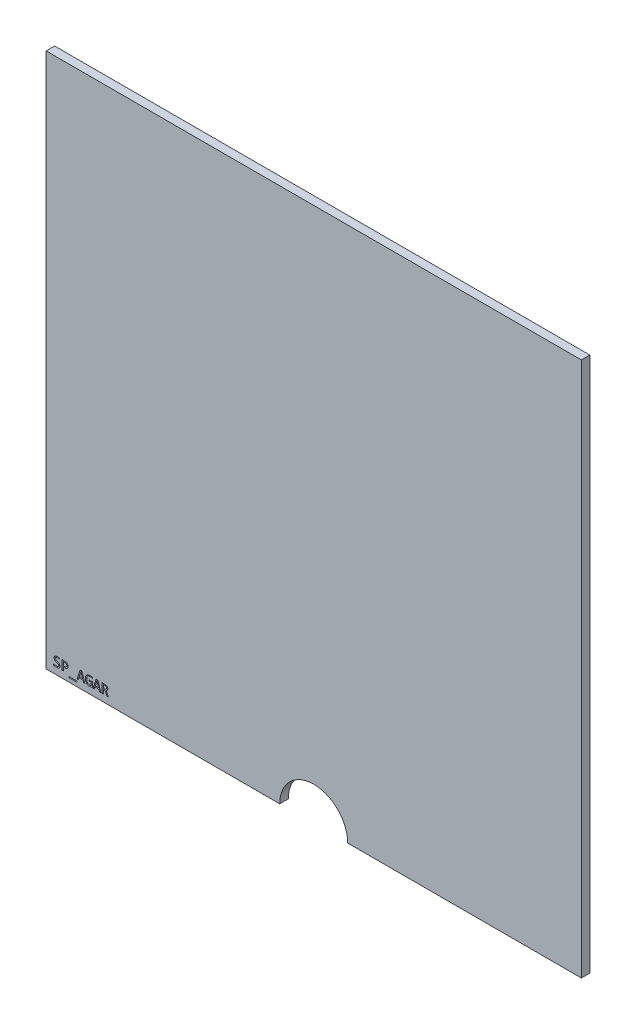
from build123d import *

# Parameters (mm, degrees)
SKETCH1_W           = 199.873
SKETCH1_H           = 199.873
BOSS_EXTRUDE1_DEPTH = 3.175
CUT_EXTRUDE3_DEPTH  = 3.175
SKETCH4_W           = 2.992753624
SKETCH4_H           = 0.405797101
CUT_EXTRUDE4_DEPTH  = 1.5875


with BuildPart() as part:
    # Sketch1 → Boss-Extrude1 (new body)
    with BuildSketch(Plane.XY):
        with Locations((99.9365, 99.9365)):
            Rectangle(SKETCH1_W, SKETCH1_H)
    extrude(amount=BOSS_EXTRUDE1_DEPTH)

    # Sketch3 → Cut-Extrude3 (cut)
    with BuildSketch(Plane.XY.offset(3.175)):
        with BuildLine():
            Line((87.2365, 0), (112.6365, 0))
            ThreePointArc((112.6365, 0), (99.9365, 12.7), (87.2365, 0))
        make_face()
    extrude(amount=-CUT_EXTRUDE3_DEPTH, mode=Mode.SUBTRACT)

    # Sketch4 → Cut-Extrude4 (cut)
    # profile 1 of 7: a face of its own
    with BuildSketch(Plane.XY.offset(3.175)):
        with BuildLine():
            add(Edge.make_bspline(
                [(5.228405797, 3.487124094), (5.227266764, 3.446625552), (5.22505706, 3.368059062), (5.205615497, 3.25373574), (5.173193105, 3.147546701), (5.128639573, 3.048765061), (5.071324609, 2.959184846), (5.005857949, 2.875573602), (4.927685272, 2.802028794), (4.841083014, 2.73506281), (4.744698491, 2.6761281), (4.638285069, 2.626529155), (4.523301542, 2.583680145), (4.399428448, 2.549130879), (4.267773395, 2.522273494), (4.128986235, 2.503823356), (3.983764262, 2.491370796), (3.884758327, 2.48998304), (3.834270833, 2.489275362)],
                knots=[0, 0, 0, 0, 1.005643061, 1.95093061, 2.870738502, 3.757832008, 4.633806625, 5.507195241, 6.389247641, 7.292512577, 8.223494331, 9.189475669, 10.205094408, 11.269007441, 12.381228937, 13.540657028, 14.745872513, 16, 16, 16, 16], degree=3))
            add(Edge.make_bspline(
                [(3.834270833, 2.489275362), (3.787766914, 2.489796415), (3.694981735, 2.490836027), (3.557002566, 2.497209299), (3.422014443, 2.507737719), (3.292034494, 2.520398072), (3.168047801, 2.534471705), (3.05169692, 2.550748169), (2.944449477, 2.569673872), (2.876545875, 2.583953585), (2.844347826, 2.590724638)],
                knots=[0, 0, 0, 0, 1.119729043, 2.234096861, 3.324996266, 4.379512959, 5.378439906, 6.329323539, 7.207810484, 8, 8, 8, 8], degree=3))
            Line((2.844347826, 2.590724638), (2.844347826, 3.047246377))
            add(Edge.make_bspline(
                [(2.844347826, 3.047246377), (2.878819954, 3.035435179), (2.949255196, 3.011301925), (3.059739435, 2.98299581), (3.175633781, 2.956411992), (3.298039502, 2.934202867), (3.428149129, 2.916723199), (3.56645907, 2.90442996), (3.713433951, 2.896105078), (3.814180087, 2.89542308), (3.865973732, 2.895072464)],
                knots=[0, 0, 0, 0, 0.842364813, 1.72116351, 2.635659137, 3.591954833, 4.596841017, 5.670471508, 6.802388115, 8, 8, 8, 8], degree=3))
            add(Edge.make_bspline(
                [(3.865973732, 2.895072464), (3.902977798, 2.895453386), (3.974153504, 2.896186074), (4.076714073, 2.903846153), (4.170893397, 2.913832958), (4.256488592, 2.931179209), (4.334358709, 2.951144887), (4.404743483, 2.976551906), (4.467531865, 3.006787736), (4.523819188, 3.040683462), (4.572058653, 3.079846937), (4.614351908, 3.122053382), (4.648292378, 3.169136711), (4.675862477, 3.219979551), (4.696243596, 3.274753843), (4.710397006, 3.333314957), (4.719300388, 3.395443244), (4.720528803, 3.438217909), (4.72115942, 3.46017663)],
                knots=[0, 0, 0, 0, 1.523194236, 2.929797672, 4.233142745, 5.41923506, 6.522104548, 7.540643951, 8.494207191, 9.387815665, 10.238903194, 11.04655015, 11.840679357, 12.619387111, 13.4214478, 14.239285369, 15.096122854, 16, 16, 16, 16], degree=3))
            add(Edge.make_bspline(
                [(4.72115942, 3.46017663), (4.720372425, 3.48299288), (4.7188348, 3.527571032), (4.70312902, 3.591525071), (4.678573143, 3.650832352), (4.64257298, 3.703725584), (4.600266558, 3.753423272), (4.550566152, 3.798962158), (4.495703863, 3.842997309), (4.412458886, 3.898373471), (4.295976068, 3.963442677), (4.140807768, 4.028512906), (3.976261288, 4.093847352), (3.807392378, 4.161991506), (3.638566522, 4.234326796), (3.472941708, 4.310958307), (3.31760458, 4.39887056), (3.200632959, 4.486103075), (3.118908143, 4.564653124), (3.063309585, 4.627547471), (3.015603636, 4.696227572), (2.971534045, 4.768264424), (2.937055755, 4.847872951), (2.913134645, 4.93430508), (2.897259757, 5.027571644), (2.89581851, 5.092013653), (2.895072464, 5.125371377)],
                knots=[0, 0, 0, 0, 0.619815692, 1.2109895, 1.781199776, 2.357496674, 2.943929778, 3.554333405, 4.188738872, 4.856760597, 6.272963823, 7.811824644, 9.431291666, 11.092170587, 12.76691914, 14.429617761, 16.056218893, 17.616396577, 18.384212937, 19.138341755, 19.896401647, 20.65718422, 21.4332038, 22.247956952, 23.09307348, 24, 24, 24, 24], degree=3))
            add(Edge.make_bspline(
                [(2.895072464, 5.125371377), (2.895981812, 5.155282444), (2.897802742, 5.215178069), (2.912844759, 5.304676278), (2.936502024, 5.393392489), (2.969807578, 5.481004027), (3.013433636, 5.565483216), (3.066527686, 5.646472931), (3.131743266, 5.721041003), (3.206524054, 5.791352689), (3.293039001, 5.855683015), (3.390206809, 5.914366786), (3.499608282, 5.964728655), (3.619149197, 6.010430745), (3.751239492, 6.046708687), (3.895224255, 6.072699081), (4.051131666, 6.08736788), (4.158930699, 6.089580061), (4.214705616, 6.090724638)],
                knots=[0, 0, 0, 0, 0.784067079, 1.570060577, 2.373452904, 3.189297991, 4.022898002, 4.862695015, 5.722463422, 6.614650011, 7.550049647, 8.544652583, 9.586108202, 10.704431291, 11.897970904, 13.172772987, 14.537200697, 16, 16, 16, 16], degree=3))
            add(Edge.make_bspline(
                [(4.214705616, 6.090724638), (4.245891922, 6.090522584), (4.310704848, 6.090102665), (4.410570232, 6.08292358), (4.514731163, 6.073869386), (4.620646371, 6.060899173), (4.726384643, 6.046092082), (4.830192456, 6.028634687), (4.929843484, 6.010002367), (4.994361992, 5.996023454), (5.025507246, 5.989275362)],
                knots=[0, 0, 0, 0, 0.91416123, 1.89985515, 2.934260182, 3.979599391, 5.027947684, 6.064525625, 7.065681407, 8, 8, 8, 8], degree=3))
            Line((5.025507246, 5.989275362), (5.025507246, 5.583478261))
            add(Edge.make_bspline(
                [(5.025507246, 5.583478261), (4.956183349, 5.598853842), (4.818223137, 5.629452503), (4.610592859, 5.659976163), (4.406687986, 5.681352467), (4.272087657, 5.683750095), (4.205987319, 5.684927536)],
                knots=[0, 0, 0, 0, 1.029411825, 2.048613503, 3.041701399, 4, 4, 4, 4], degree=3))
            add(Edge.make_bspline(
                [(4.205987319, 5.684927536), (4.172690979, 5.684418592), (4.108149628, 5.683432059), (4.014711488, 5.677366544), (3.928194847, 5.666259452), (3.848511804, 5.65123715), (3.775442151, 5.632646828), (3.709210768, 5.609028635), (3.650182539, 5.580199516), (3.597364292, 5.547808177), (3.5515315, 5.511139497), (3.51124071, 5.472210953), (3.477602281, 5.4298804), (3.450448934, 5.384155385), (3.429199273, 5.335643847), (3.412696302, 5.284548642), (3.404320417, 5.230002438), (3.402996136, 5.192763781), (3.402318841, 5.173718297)],
                knots=[0, 0, 0, 0, 1.491437277, 2.890989782, 4.191431573, 5.395946596, 6.521058188, 7.565423013, 8.539223212, 9.458660202, 10.334655275, 11.163081303, 11.963306063, 12.748694206, 13.538083787, 14.331542868, 15.146677777, 16, 16, 16, 16], degree=3))
            add(Edge.make_bspline(
                [(3.402318841, 5.173718297), (3.403104951, 5.150904278), (3.404640847, 5.106330482), (3.420417447, 5.04210732), (3.445104611, 4.982633271), (3.479620604, 4.928089093), (3.523588994, 4.879476368), (3.571982195, 4.832189166), (3.627038764, 4.78782674), (3.710120581, 4.731025805), (3.827631124, 4.666295603), (3.982038875, 4.598381625), (4.147497871, 4.534908954), (4.315968102, 4.466096529), (4.48540011, 4.394513757), (4.623487314, 4.327921333), (4.730656938, 4.270757171), (4.805760309, 4.222836293), (4.8770712, 4.172295367), (4.94264164, 4.116458564), (5.004175029, 4.057402372), (5.059180937, 3.992488782), (5.108248335, 3.923131391), (5.150556911, 3.848632473), (5.186744812, 3.768840648), (5.210343139, 3.681054616), (5.226224779, 3.586508637), (5.227662114, 3.521012218), (5.228405797, 3.487124094)],
                knots=[0, 0, 0, 0, 0.667485538, 1.304126353, 1.925325377, 2.548259058, 3.18485279, 3.841928735, 4.529978862, 5.253739616, 6.789399884, 8.452896455, 10.194043647, 11.982660287, 13.786213269, 15.583473082, 16.473910229, 17.343881083, 18.192645259, 19.033319022, 19.865571682, 20.689426309, 21.522902605, 22.351690537, 23.197589349, 24.082454772, 25.007853999, 26, 26, 26, 26], degree=3))
        make_face()
    # profile 2 of 7: a face of its own
    with BuildSketch(Plane.XY.offset(3.175)):
        with BuildLine():
            add(Edge.make_bspline(
                [(8.22115942, 4.974782609), (8.220302894, 4.939326782), (8.218582139, 4.868096333), (8.202696182, 4.761757409), (8.178096863, 4.655988321), (8.144304843, 4.551484574), (8.099987867, 4.44979002), (8.044608656, 4.352717353), (7.976911398, 4.2620901), (7.900331233, 4.175978832), (7.811787003, 4.097275926), (7.711702304, 4.026363923), (7.60036061, 3.963232209), (7.478096, 3.907053241), (7.34330574, 3.862967387), (7.196363773, 3.83025246), (7.036747941, 3.811546406), (6.926144982, 3.809284148), (6.869030797, 3.808115942)],
                knots=[0, 0, 0, 0, 0.84837333, 1.704374698, 2.568122001, 3.446177459, 4.329841521, 5.219461111, 6.115085959, 7.03322926, 7.973947317, 8.94447037, 9.964314875, 11.034235969, 12.160282575, 13.352588404, 14.632904974, 16, 16, 16, 16], degree=3))
            Line((6.869030797, 3.808115942), (6.445797101, 3.808115942))
            Line((6.445797101, 3.808115942), (6.445797101, 2.54))
            Line((6.445797101, 2.54), (5.938550725, 2.54))
            Line((5.938550725, 2.54), (5.938550725, 6.04))
            Line((5.938550725, 6.04), (6.917377717, 6.04))
            add(Edge.make_bspline(
                [(6.917377717, 6.04), (6.959941394, 6.039549216), (7.044426355, 6.038654453), (7.169516284, 6.026676321), (7.292187032, 6.009802458), (7.411439952, 5.984576676), (7.52594833, 5.951481773), (7.634735935, 5.911085502), (7.734797955, 5.858396307), (7.82875908, 5.799354905), (7.915294548, 5.731198941), (7.991423015, 5.652104844), (8.05856476, 5.563992966), (8.11671534, 5.467070451), (8.164593236, 5.359695254), (8.196770828, 5.240725181), (8.218372446, 5.111360667), (8.220208647, 5.021376049), (8.22115942, 4.974782609)],
                knots=[0, 0, 0, 0, 1.071095419, 2.126025337, 3.160633674, 4.187194637, 5.191188192, 6.159546808, 7.102471747, 8.032359578, 8.950543616, 9.867691343, 10.788184798, 11.733733012, 12.707489344, 13.737062018, 14.82826569, 16, 16, 16, 16], degree=3))
        make_face()
        with BuildLine():
            add(Edge.make_bspline(
                [(7.713913043, 4.947835145), (7.713407051, 4.974818736), (7.712420853, 5.027410763), (7.701819742, 5.1035743), (7.685125987, 5.174967865), (7.66238668, 5.241529586), (7.632908306, 5.303457597), (7.596049145, 5.359904763), (7.552976997, 5.412049222), (7.502962119, 5.45866116), (7.44698721, 5.499691387), (7.386732484, 5.536780189), (7.320255297, 5.566751134), (7.24847029, 5.591047145), (7.171773898, 5.611244221), (7.089422495, 5.623954604), (7.002401702, 5.633391921), (6.942504142, 5.633928241), (6.91182971, 5.634202899)],
                knots=[0, 0, 0, 0, 1.07893025, 2.102875295, 3.069403633, 4.00867391, 4.911619206, 5.805799344, 6.69897942, 7.61127936, 8.532960211, 9.47193309, 10.436783978, 11.442898866, 12.50165651, 13.605056338, 14.773513735, 16, 16, 16, 16], degree=3))
            Line((6.91182971, 5.634202899), (6.445797101, 5.634202899))
            Line((6.445797101, 5.634202899), (6.445797101, 4.213913043))
            Line((6.445797101, 4.213913043), (6.871408514, 4.213913043))
            add(Edge.make_bspline(
                [(6.871408514, 4.213913043), (6.904182755, 4.214623908), (6.967714485, 4.216001896), (7.060450992, 4.223725056), (7.147483266, 4.237616516), (7.228416757, 4.258512851), (7.303599878, 4.283741726), (7.37316686, 4.314559597), (7.436759035, 4.352093161), (7.494875668, 4.394874743), (7.547116002, 4.443314655), (7.591486254, 4.498715821), (7.629884201, 4.559147433), (7.661095556, 4.62570411), (7.684456906, 4.69826228), (7.701993074, 4.776208811), (7.712420235, 4.860104967), (7.713404544, 4.917951365), (7.713913043, 4.947835145)],
                knots=[0, 0, 0, 0, 1.232805628, 2.389751021, 3.4973379, 4.54330244, 5.530003372, 6.477393866, 7.399377973, 8.301660217, 9.187431021, 10.070466494, 10.963674817, 11.874940633, 12.827061481, 13.825105319, 14.876436953, 16, 16, 16, 16], degree=3))
        make_face(mode=Mode.SUBTRACT)
    # profile 3 of 7: a face of its own
    with BuildSketch(Plane.XY.offset(3.175)):
        with Locations((10.021884058, 1.626956522)):
            Rectangle(SKETCH4_W, SKETCH4_H)
    # profile 4 of 7: a face of its own
    with BuildSketch(Plane.XY.offset(3.175)):
        Polygon((14.485652174, 2.54), (13.96651721, 2.54), (13.731915761, 3.300869565), (12.278337862, 3.300869565), (12.038188406, 2.54), (11.543623188, 2.54), (12.707119565, 6.04), (13.359406703, 6.04), align=None)
        Polygon((13.607481884, 3.706666667), (13.014637681, 5.631825181), (12.406734601, 3.706666667), align=None, mode=Mode.SUBTRACT)
    # profile 5 of 7: a face of its own
    with BuildSketch(Plane.XY.offset(3.175)):
        with BuildLine():
            add(Edge.make_bspline(
                [(17.250144928, 5.482028986), (17.182806781, 5.511978827), (17.048533315, 5.571699345), (16.87208751, 5.625300698), (16.726893041, 5.65625715), (16.613045117, 5.672665486), (16.494501456, 5.68338069), (16.413740738, 5.684406896), (16.37276721, 5.684927536)],
                knots=[0, 0, 0, 0, 1.45945927, 2.910187841, 3.643322816, 4.400006487, 5.188251666, 6, 6, 6, 6], degree=3))
            add(Edge.make_bspline(
                [(16.37276721, 5.684927536), (16.326193959, 5.683803129), (16.235282716, 5.681608279), (16.103133424, 5.661793954), (15.978363469, 5.631676224), (15.862471477, 5.586724129), (15.754877064, 5.531098619), (15.655595804, 5.464764861), (15.565203172, 5.387851723), (15.483977739, 5.300617041), (15.411042876, 5.204303764), (15.349121726, 5.097187075), (15.293677294, 4.982025168), (15.249188548, 4.857287873), (15.212959692, 4.724928879), (15.189666574, 4.584920992), (15.172467647, 4.438635229), (15.171121905, 4.338665689), (15.170434783, 4.287622283)],
                knots=[0, 0, 0, 0, 1.073569988, 2.0956145, 3.075462191, 4.028316933, 4.954955511, 5.864200373, 6.776299374, 7.685952519, 8.608514939, 9.556388192, 10.53488969, 11.552674678, 12.606592505, 13.695564134, 14.823379042, 16, 16, 16, 16], degree=3))
            add(Edge.make_bspline(
                [(15.170434783, 4.287622283), (15.171169335, 4.234499795), (15.172596544, 4.131284738), (15.184421139, 3.980352608), (15.205208807, 3.838326192), (15.232153115, 3.704202904), (15.2693269, 3.579794763), (15.315364993, 3.464836244), (15.37011566, 3.359383365), (15.434164881, 3.263691992), (15.508666807, 3.178903883), (15.592511867, 3.104558254), (15.686090395, 3.040918287), (15.78897782, 2.987080335), (15.902709061, 2.946294944), (16.02612282, 2.915917399), (16.160412006, 2.898834156), (16.253305723, 2.896356292), (16.301435688, 2.895072464)],
                knots=[0, 0, 0, 0, 1.243148344, 2.415391902, 3.539864978, 4.600895424, 5.61417527, 6.574020235, 7.494941044, 8.390096718, 9.261974012, 10.129213218, 11.00555139, 11.904308457, 12.839297802, 13.826028221, 14.87362472, 16, 16, 16, 16], degree=3))
            add(Edge.make_bspline(
                [(16.301435688, 2.895072464), (16.319143016, 2.895452788), (16.35591645, 2.896242621), (16.412484563, 2.900414017), (16.470951659, 2.90643611), (16.529801397, 2.915563979), (16.587833677, 2.925350484), (16.643701854, 2.937869364), (16.695257652, 2.952611824), (16.727626383, 2.964136649), (16.742898551, 2.969574275)],
                knots=[0, 0, 0, 0, 0.945101657, 1.962726016, 3.026203458, 4.081046807, 5.14040368, 6.166587829, 7.134962126, 8, 8, 8, 8], degree=3))
            Line((16.742898551, 2.969574275), (16.742898551, 4.112463768))
            Line((16.742898551, 4.112463768), (16.039094203, 4.112463768))
            Line((16.039094203, 4.112463768), (16.039094203, 4.51826087))
            Line((16.039094203, 4.51826087), (17.250144928, 4.51826087))
            Line((17.250144928, 4.51826087), (17.250144928, 2.7040625))
            add(Edge.make_bspline(
                [(17.250144928, 2.7040625), (17.212030466, 2.687209541), (17.134620574, 2.652981437), (17.013509459, 2.609920196), (16.888006837, 2.572995057), (16.759782049, 2.541941469), (16.630357029, 2.518286463), (16.501732082, 2.502094738), (16.375867827, 2.490982207), (16.293004167, 2.489837645), (16.252296196, 2.489275362)],
                knots=[0, 0, 0, 0, 0.972427008, 1.974984516, 2.997371287, 4.024859125, 5.052920405, 6.066341974, 7.050062525, 8, 8, 8, 8], degree=3))
            add(Edge.make_bspline(
                [(16.252296196, 2.489275362), (16.192516881, 2.490549453), (16.075728807, 2.493038584), (15.905256974, 2.515274874), (15.743727748, 2.549480568), (15.591461347, 2.598767242), (15.449568762, 2.662014428), (15.317869162, 2.738920694), (15.197107688, 2.829274622), (15.087712854, 2.933851987), (14.990702252, 3.052357507), (14.904212218, 3.183681128), (14.832166482, 3.329870624), (14.769457878, 3.488255203), (14.721570471, 3.660689086), (14.688096188, 3.846156273), (14.667109295, 4.0443509), (14.664521751, 4.180834715), (14.663188406, 4.251163949)],
                knots=[0, 0, 0, 0, 1.063600106, 2.077906186, 3.054673402, 3.998980003, 4.920963561, 5.814580945, 6.708049843, 7.599412522, 8.501355178, 9.428695674, 10.391875437, 11.396983258, 12.456970005, 13.571147305, 14.748427771, 16, 16, 16, 16], degree=3))
            add(Edge.make_bspline(
                [(14.663188406, 4.251163949), (14.66473007, 4.321234262), (14.667746396, 4.458329538), (14.690669068, 4.658107727), (14.729684379, 4.84663748), (14.783231229, 5.023466999), (14.85144206, 5.188384709), (14.933425414, 5.339812268), (15.026352309, 5.479490294), (15.133091482, 5.60489742), (15.251454232, 5.717268475), (15.3817524, 5.815145369), (15.522452685, 5.899863312), (15.67485881, 5.968617982), (15.836566965, 6.023121167), (16.007093479, 6.063142199), (16.185885016, 6.086052266), (16.30771206, 6.089150711), (16.36959692, 6.090724638)],
                knots=[0, 0, 0, 0, 1.187604435, 2.323594002, 3.403022287, 4.447090083, 5.450927467, 6.422737292, 7.361747858, 8.289531684, 9.208213513, 10.122694231, 11.046633145, 11.986550994, 12.950975564, 13.935151001, 14.951112262, 16, 16, 16, 16], degree=3))
            add(Edge.make_bspline(
                [(16.36959692, 6.090724638), (16.4484184, 6.089304178), (16.602612794, 6.086525405), (16.792348147, 6.061949095), (16.938516804, 6.034804237), (17.044841143, 6.008450996), (17.148962635, 5.977063325), (17.216468098, 5.951368998), (17.250144928, 5.938550725)],
                knots=[0, 0, 0, 0, 1.577605647, 3.086188538, 3.823906723, 4.553997738, 5.27862473, 6, 6, 6, 6], degree=3))
            Line((17.250144928, 5.938550725), (17.250144928, 5.482028986))
        make_face()
    # profile 6 of 7: a face of its own
    with BuildSketch(Plane.XY.offset(3.175)):
        Polygon((20.47115942, 2.54), (19.952024457, 2.54), (19.717423007, 3.300869565), (18.263845109, 3.300869565), (18.023695652, 2.54), (17.529130435, 2.54), (18.692626812, 6.04), (19.344913949, 6.04), align=None)
        Polygon((19.59298913, 3.706666667), (19.000144928, 5.631825181), (18.392241848, 3.706666667), align=None, mode=Mode.SUBTRACT)
    # profile 7 of 7: a face of its own
    with BuildSketch(Plane.XY.offset(3.175)):
        with BuildLine():
            Line((23.286376812, 2.54), (22.749012681, 2.54))
            Line((22.749012681, 2.54), (22.245729167, 3.632957428))
            add(Edge.make_bspline(
                [(22.245729167, 3.632957428), (22.22754342, 3.671706773), (22.193806601, 3.743591622), (22.134405718, 3.837982497), (22.072882901, 3.914032892), (22.006239721, 3.972499767), (21.933534151, 4.015154031), (21.854305587, 4.042750588), (21.767404678, 4.058792395), (21.706853095, 4.060724962), (21.675076993, 4.06173913)],
                knots=[0, 0, 0, 0, 1.339134837, 2.484261414, 3.482991323, 4.391871607, 5.244507385, 6.105289549, 7.005698766, 8, 8, 8, 8], degree=3))
            Line((21.675076993, 4.06173913), (21.460289855, 4.06173913))
            Line((21.460289855, 4.06173913), (21.460289855, 2.54))
            Line((21.460289855, 2.54), (20.953043478, 2.54))
            Line((20.953043478, 2.54), (20.953043478, 6.04))
            Line((20.953043478, 6.04), (21.883523551, 6.04))
            add(Edge.make_bspline(
                [(21.883523551, 6.04), (21.9324299, 6.039366361), (22.026722454, 6.038144689), (22.162871919, 6.025266173), (22.288375069, 6.004490516), (22.403038407, 5.974095291), (22.507638981, 5.936954567), (22.602535254, 5.892570659), (22.687740175, 5.841200811), (22.762928229, 5.78258738), (22.829396971, 5.71862251), (22.88517697, 5.646973978), (22.932477508, 5.569801302), (22.969599187, 5.485927791), (22.997746031, 5.397009504), (23.01875607, 5.303467957), (23.030485816, 5.205195092), (23.031989414, 5.138082264), (23.032753623, 5.10397192)],
                knots=[0, 0, 0, 0, 1.390037284, 2.680023546, 3.883960013, 5.002565466, 6.047913656, 7.03574216, 7.976084698, 8.870016629, 9.741095147, 10.591561451, 11.444313202, 12.308368875, 13.191986167, 14.092206828, 15.030357037, 16, 16, 16, 16], degree=3))
            add(Edge.make_bspline(
                [(23.032753623, 5.10397192), (23.03212023, 5.076470167), (23.030874584, 5.022384571), (23.021718934, 4.942416754), (23.007855725, 4.864646937), (22.987083404, 4.78943529), (22.960888528, 4.717074993), (22.929252746, 4.647623321), (22.89086214, 4.581847098), (22.847405833, 4.519061153), (22.797960232, 4.460279445), (22.743352113, 4.405303891), (22.682275584, 4.355425286), (22.617089624, 4.308559939), (22.5460113, 4.267093549), (22.469758896, 4.231662975), (22.388720441, 4.201184091), (22.332263604, 4.185973394), (22.303586957, 4.178247283)],
                knots=[0, 0, 0, 0, 1.032708305, 2.030948508, 3.019625047, 3.996933367, 4.957424013, 5.907556856, 6.85893238, 7.814077788, 8.77200233, 9.740252168, 10.719774328, 11.730219428, 12.753012585, 13.805036997, 14.885091985, 16, 16, 16, 16], degree=3))
            add(Edge.make_bspline(
                [(22.303586957, 4.178247283), (22.326895145, 4.169698355), (22.373140149, 4.15273671), (22.436723447, 4.114964981), (22.496525913, 4.071060751), (22.548824529, 4.014951285), (22.599958672, 3.951752522), (22.650645098, 3.878930821), (22.702116393, 3.796752178), (22.734529176, 3.737493302), (22.751390399, 3.706666667)],
                knots=[0, 0, 0, 0, 0.890820497, 1.767447404, 2.649001527, 3.549193506, 4.515009134, 5.571837998, 6.736863216, 8, 8, 8, 8], degree=3))
            Line((22.751390399, 3.706666667), (23.286376812, 2.54))
        make_face()
        with BuildLine():
            add(Edge.make_bspline(
                [(22.525507246, 5.069891304), (22.525136163, 5.092898772), (22.524417172, 5.137476789), (22.516459118, 5.202004947), (22.502841541, 5.261916103), (22.484701702, 5.31743245), (22.4620379, 5.369077043), (22.431980301, 5.415069931), (22.398053555, 5.457386547), (22.358864991, 5.494918851), (22.314730861, 5.527569148), (22.266239376, 5.555946413), (22.213840097, 5.580685313), (22.157020234, 5.600650541), (22.095853046, 5.615246859), (22.030509047, 5.626626993), (21.96078092, 5.63267721), (21.912858874, 5.633685654), (21.888278986, 5.634202899)],
                knots=[0, 0, 0, 0, 1.136086502, 2.201219443, 3.204852043, 4.166451082, 5.083443327, 5.98129036, 6.87199526, 7.758098985, 8.653381414, 9.577773354, 10.529401831, 11.511765708, 12.546811162, 13.632454437, 14.78565276, 16, 16, 16, 16], degree=3))
            Line((21.888278986, 5.634202899), (21.460289855, 5.634202899))
            Line((21.460289855, 5.634202899), (21.460289855, 4.467536232))
            Line((21.460289855, 4.467536232), (21.827250906, 4.467536232))
            add(Edge.make_bspline(
                [(21.827250906, 4.467536232), (21.853416619, 4.468003869), (21.904528707, 4.468917352), (21.979088525, 4.475692333), (22.0493304, 4.489058388), (22.115951272, 4.504864927), (22.177981886, 4.527282772), (22.235104783, 4.554404318), (22.288281235, 4.585111584), (22.335605103, 4.621980881), (22.378994376, 4.662522944), (22.416969131, 4.707783842), (22.450004136, 4.757355499), (22.476675373, 4.81191407), (22.499451722, 4.870238954), (22.513786567, 4.933570044), (22.523888477, 5.00034894), (22.524958965, 5.046337111), (22.525507246, 5.069891304)],
                knots=[0, 0, 0, 0, 1.202615583, 2.349188572, 3.435207305, 4.486530095, 5.492783739, 6.45958443, 7.390413995, 8.308405015, 9.210274755, 10.115082188, 11.017605575, 11.940721498, 12.901403136, 13.887978084, 14.918265918, 16, 16, 16, 16], degree=3))
        make_face(mode=Mode.SUBTRACT)
    extrude(amount=-CUT_EXTRUDE4_DEPTH, mode=Mode.SUBTRACT)


solid = part.part
